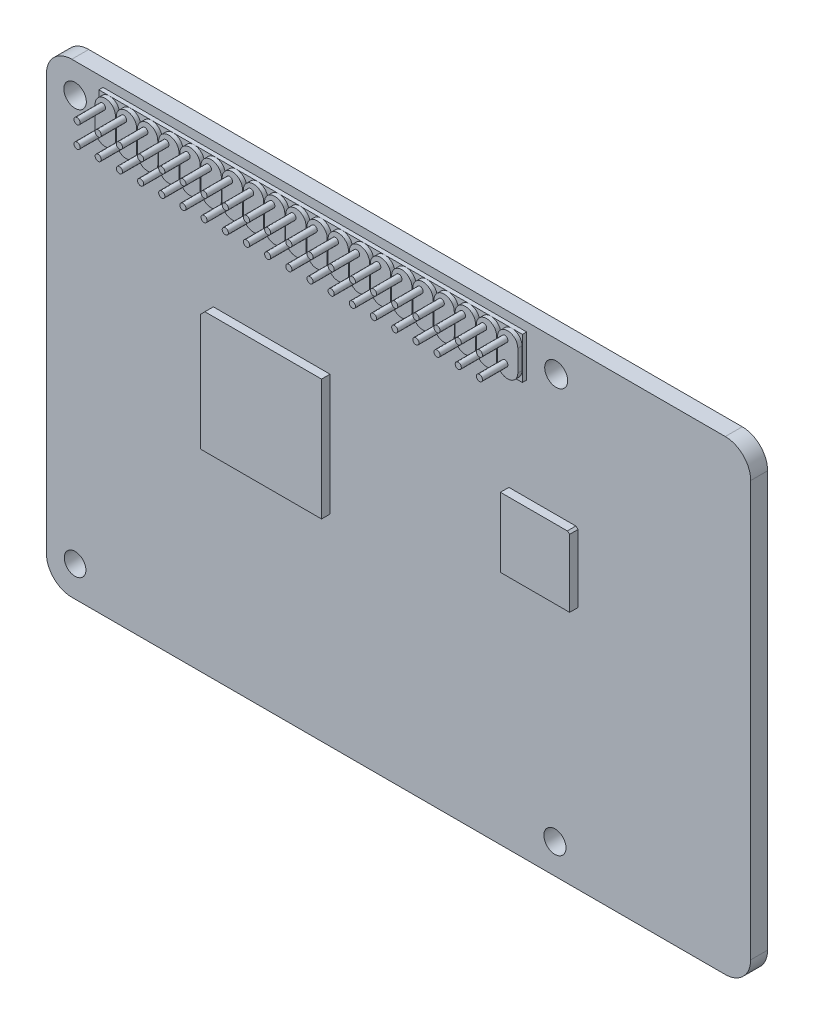
from build123d import *

# Parameters (mm, degrees)
BOSS_EXTRU_6_DEPTH      = 2
BOSS_EXTRU_8_DEPTH      = 1
ESQUISSE19_W            = 50.000582169
ESQUISSE19_H            = 4.923492373
BOSS_EXTRU_9_DEPTH      = 0.5
ESQUISSE20_R            = 0.361395421
BOSS_EXTRU_10_DEPTH     = 3
BOSS_EXTRU_11_DEPTH     = 1
BOSS_EXTRU_12_DEPTH     = 1
ESQUISSE23_R            = 1.328244068
ESQUISSE23_R_2          = 1.273931832
ESQUISSE23_R_3          = 1.307593734
ESQUISSE23_R_4          = 1.354217853
ENL_V_MAT_EXTRU_1_DEPTH = 21
ESQUISSE24_W            = 11.521914809
ESQUISSE24_H            = 11.164250047
BOSS_EXTRU_13_DEPTH     = 0.6
ESQUISSE25_W            = 0.5
ESQUISSE25_H            = 11
ENL_V_MAT_EXTRU_2_DEPTH = 11


with BuildPart() as part:
    # Esquisse13 → Boss.-Extru.6 (new body)
    with BuildSketch(Plane.XY):
        with BuildLine():
            Line((32.305129896, 231.75292532), (109.445129896, 231.75292532))
            ThreePointArc((109.445129896, 231.75292532), (111.56645024, 230.874245664), (112.445129896, 228.75292532))
            Line((112.445129896, 228.75292532), (112.445129896, 179.75292532))
            ThreePointArc((112.445129896, 179.75292532), (111.56645024, 177.631604977), (109.445129896, 176.75292532))
            Line((109.445129896, 176.75292532), (32.305129896, 176.75292532))
            ThreePointArc((32.305129896, 176.75292532), (30.183809552, 177.631604977), (29.305129896, 179.75292532))
            Line((29.305129896, 179.75292532), (29.305129896, 228.75292532))
            ThreePointArc((29.305129896, 228.75292532), (30.183809552, 230.874245664), (32.305129896, 231.75292532))
        make_face()
    extrude(amount=BOSS_EXTRU_6_DEPTH)

    # Esquisse18 → Boss.-Extru.8 (add)
    with BuildSketch(Plane.XY.offset(2)):
        with BuildLine():
            Line((38.45390288, 229.525786003), (38.45390288, 226.996845752))
            ThreePointArc((38.45390288, 226.996845752), (37.256626819, 225.799569691), (36.059350758, 226.996845752))
            Line((36.059350758, 226.996845752), (36.059350758, 229.525786003))
            ThreePointArc((36.059350758, 229.525786003), (37.256626819, 230.723062064), (38.45390288, 229.525786003))
        make_face()
        with BuildLine():
            Line((40.95390288, 229.525786003), (40.95390288, 226.996845752))
            ThreePointArc((40.95390288, 226.996845752), (39.756626819, 225.799569691), (38.559350758, 226.996845752))
            Line((38.559350758, 226.996845752), (38.559350758, 229.525786003))
            ThreePointArc((38.559350758, 229.525786003), (39.756626819, 230.723062064), (40.95390288, 229.525786003))
        make_face()
        with BuildLine():
            Line((43.45390288, 229.525786003), (43.45390288, 226.996845752))
            ThreePointArc((43.45390288, 226.996845752), (42.256626819, 225.799569691), (41.059350758, 226.996845752))
            Line((41.059350758, 226.996845752), (41.059350758, 229.525786003))
            ThreePointArc((41.059350758, 229.525786003), (42.256626819, 230.723062064), (43.45390288, 229.525786003))
        make_face()
        with BuildLine():
            Line((45.95390288, 229.525786003), (45.95390288, 226.996845752))
            ThreePointArc((45.95390288, 226.996845752), (44.756626819, 225.799569691), (43.559350758, 226.996845752))
            Line((43.559350758, 226.996845752), (43.559350758, 229.525786003))
            ThreePointArc((43.559350758, 229.525786003), (44.756626819, 230.723062064), (45.95390288, 229.525786003))
        make_face()
        with BuildLine():
            Line((48.45390288, 229.525786003), (48.45390288, 226.996845752))
            ThreePointArc((48.45390288, 226.996845752), (47.256626819, 225.799569691), (46.059350758, 226.996845752))
            Line((46.059350758, 226.996845752), (46.059350758, 229.525786003))
            ThreePointArc((46.059350758, 229.525786003), (47.256626819, 230.723062064), (48.45390288, 229.525786003))
        make_face()
        with BuildLine():
            Line((50.95390288, 229.525786003), (50.95390288, 226.996845752))
            ThreePointArc((50.95390288, 226.996845752), (49.756626819, 225.799569691), (48.559350758, 226.996845752))
            Line((48.559350758, 226.996845752), (48.559350758, 229.525786003))
            ThreePointArc((48.559350758, 229.525786003), (49.756626819, 230.723062064), (50.95390288, 229.525786003))
        make_face()
        with BuildLine():
            Line((53.45390288, 229.525786003), (53.45390288, 226.996845752))
            ThreePointArc((53.45390288, 226.996845752), (52.256626819, 225.799569691), (51.059350758, 226.996845752))
            Line((51.059350758, 226.996845752), (51.059350758, 229.525786003))
            ThreePointArc((51.059350758, 229.525786003), (52.256626819, 230.723062064), (53.45390288, 229.525786003))
        make_face()
        with BuildLine():
            Line((55.95390288, 229.525786003), (55.95390288, 226.996845752))
            ThreePointArc((55.95390288, 226.996845752), (54.756626819, 225.799569691), (53.559350758, 226.996845752))
            Line((53.559350758, 226.996845752), (53.559350758, 229.525786003))
            ThreePointArc((53.559350758, 229.525786003), (54.756626819, 230.723062064), (55.95390288, 229.525786003))
        make_face()
        with BuildLine():
            Line((58.45390288, 229.525786003), (58.45390288, 226.996845752))
            ThreePointArc((58.45390288, 226.996845752), (57.256626819, 225.799569691), (56.059350758, 226.996845752))
            Line((56.059350758, 226.996845752), (56.059350758, 229.525786003))
            ThreePointArc((56.059350758, 229.525786003), (57.256626819, 230.723062064), (58.45390288, 229.525786003))
        make_face()
        with BuildLine():
            Line((60.95390288, 229.525786003), (60.95390288, 226.996845752))
            ThreePointArc((60.95390288, 226.996845752), (59.756626819, 225.799569691), (58.559350758, 226.996845752))
            Line((58.559350758, 226.996845752), (58.559350758, 229.525786003))
            ThreePointArc((58.559350758, 229.525786003), (59.756626819, 230.723062064), (60.95390288, 229.525786003))
        make_face()
        with BuildLine():
            Line((63.45390288, 229.525786003), (63.45390288, 226.996845752))
            ThreePointArc((63.45390288, 226.996845752), (62.256626819, 225.799569691), (61.059350758, 226.996845752))
            Line((61.059350758, 226.996845752), (61.059350758, 229.525786003))
            ThreePointArc((61.059350758, 229.525786003), (62.256626819, 230.723062064), (63.45390288, 229.525786003))
        make_face()
        with BuildLine():
            Line((65.95390288, 229.525786003), (65.95390288, 226.996845752))
            ThreePointArc((65.95390288, 226.996845752), (64.756626819, 225.799569691), (63.559350758, 226.996845752))
            Line((63.559350758, 226.996845752), (63.559350758, 229.525786003))
            ThreePointArc((63.559350758, 229.525786003), (64.756626819, 230.723062064), (65.95390288, 229.525786003))
        make_face()
        with BuildLine():
            Line((68.45390288, 229.525786003), (68.45390288, 226.996845752))
            ThreePointArc((68.45390288, 226.996845752), (67.256626819, 225.799569691), (66.059350758, 226.996845752))
            Line((66.059350758, 226.996845752), (66.059350758, 229.525786003))
            ThreePointArc((66.059350758, 229.525786003), (67.256626819, 230.723062064), (68.45390288, 229.525786003))
        make_face()
        with BuildLine():
            Line((70.95390288, 229.525786003), (70.95390288, 226.996845752))
            ThreePointArc((70.95390288, 226.996845752), (69.756626819, 225.799569691), (68.559350758, 226.996845752))
            Line((68.559350758, 226.996845752), (68.559350758, 229.525786003))
            ThreePointArc((68.559350758, 229.525786003), (69.756626819, 230.723062064), (70.95390288, 229.525786003))
        make_face()
        with BuildLine():
            Line((73.45390288, 229.525786003), (73.45390288, 226.996845752))
            ThreePointArc((73.45390288, 226.996845752), (72.256626819, 225.799569691), (71.059350758, 226.996845752))
            Line((71.059350758, 226.996845752), (71.059350758, 229.525786003))
            ThreePointArc((71.059350758, 229.525786003), (72.256626819, 230.723062064), (73.45390288, 229.525786003))
        make_face()
        with BuildLine():
            Line((75.95390288, 229.525786003), (75.95390288, 226.996845752))
            ThreePointArc((75.95390288, 226.996845752), (74.756626819, 225.799569691), (73.559350758, 226.996845752))
            Line((73.559350758, 226.996845752), (73.559350758, 229.525786003))
            ThreePointArc((73.559350758, 229.525786003), (74.756626819, 230.723062064), (75.95390288, 229.525786003))
        make_face()
        with BuildLine():
            Line((78.45390288, 229.525786003), (78.45390288, 226.996845752))
            ThreePointArc((78.45390288, 226.996845752), (77.256626819, 225.799569691), (76.059350758, 226.996845752))
            Line((76.059350758, 226.996845752), (76.059350758, 229.525786003))
            ThreePointArc((76.059350758, 229.525786003), (77.256626819, 230.723062064), (78.45390288, 229.525786003))
        make_face()
        with BuildLine():
            Line((80.95390288, 229.525786003), (80.95390288, 226.996845752))
            ThreePointArc((80.95390288, 226.996845752), (79.756626819, 225.799569691), (78.559350758, 226.996845752))
            Line((78.559350758, 226.996845752), (78.559350758, 229.525786003))
            ThreePointArc((78.559350758, 229.525786003), (79.756626819, 230.723062064), (80.95390288, 229.525786003))
        make_face()
        with BuildLine():
            Line((83.45390288, 229.525786003), (83.45390288, 226.996845752))
            ThreePointArc((83.45390288, 226.996845752), (82.256626819, 225.799569691), (81.059350758, 226.996845752))
            Line((81.059350758, 226.996845752), (81.059350758, 229.525786003))
            ThreePointArc((81.059350758, 229.525786003), (82.256626819, 230.723062064), (83.45390288, 229.525786003))
        make_face()
        with BuildLine():
            Line((85.95390288, 229.525786003), (85.95390288, 226.996845752))
            ThreePointArc((85.95390288, 226.996845752), (84.756626819, 225.799569691), (83.559350758, 226.996845752))
            Line((83.559350758, 226.996845752), (83.559350758, 229.525786003))
            ThreePointArc((83.559350758, 229.525786003), (84.756626819, 230.723062064), (85.95390288, 229.525786003))
        make_face()
    extrude(amount=BOSS_EXTRU_8_DEPTH)

    # Esquisse19 → Boss.-Extru.9 (add)
    with BuildSketch(Plane.XY.offset(2)):
        with Locations((60.994551794, 228.261315878)):
            Rectangle(ESQUISSE19_W, ESQUISSE19_H)
    extrude(amount=BOSS_EXTRU_9_DEPTH)

    # Esquisse20 → Boss.-Extru.10 (add)
    with BuildSketch(Plane.XY.offset(3)):
        with Locations((36.923630674, 229.735044797)):
            Circle(ESQUISSE20_R)
        with Locations((36.923630674, 227.230180834)):
            Circle(ESQUISSE20_R)
        with Locations((39.423630674, 229.735044797)):
            Circle(ESQUISSE20_R)
        with Locations((39.423630674, 227.230180834)):
            Circle(ESQUISSE20_R)
        with Locations((41.923630674, 229.735044797)):
            Circle(ESQUISSE20_R)
        with Locations((41.923630674, 227.230180834)):
            Circle(ESQUISSE20_R)
        with Locations((44.423630674, 229.735044797)):
            Circle(ESQUISSE20_R)
        with Locations((44.423630674, 227.230180834)):
            Circle(ESQUISSE20_R)
        with Locations((46.923630674, 229.735044797)):
            Circle(ESQUISSE20_R)
        with Locations((46.923630674, 227.230180834)):
            Circle(ESQUISSE20_R)
        with Locations((49.423630674, 229.735044797)):
            Circle(ESQUISSE20_R)
        with Locations((49.423630674, 227.230180834)):
            Circle(ESQUISSE20_R)
        with Locations((51.923630674, 229.735044797)):
            Circle(ESQUISSE20_R)
        with Locations((51.923630674, 227.230180834)):
            Circle(ESQUISSE20_R)
        with Locations((54.423630674, 229.735044797)):
            Circle(ESQUISSE20_R)
        with Locations((54.423630674, 227.230180834)):
            Circle(ESQUISSE20_R)
        with Locations((56.923630674, 229.735044797)):
            Circle(ESQUISSE20_R)
        with Locations((56.923630674, 227.230180834)):
            Circle(ESQUISSE20_R)
        with Locations((59.423630674, 229.735044797)):
            Circle(ESQUISSE20_R)
        with Locations((59.423630674, 227.230180834)):
            Circle(ESQUISSE20_R)
        with Locations((61.923630674, 229.735044797)):
            Circle(ESQUISSE20_R)
        with Locations((61.923630674, 227.230180834)):
            Circle(ESQUISSE20_R)
        with Locations((64.423630674, 229.735044797)):
            Circle(ESQUISSE20_R)
        with Locations((64.423630674, 227.230180834)):
            Circle(ESQUISSE20_R)
        with Locations((66.923630674, 229.735044797)):
            Circle(ESQUISSE20_R)
        with Locations((66.923630674, 227.230180834)):
            Circle(ESQUISSE20_R)
        with Locations((69.423630674, 229.735044797)):
            Circle(ESQUISSE20_R)
        with Locations((69.423630674, 227.230180834)):
            Circle(ESQUISSE20_R)
        with Locations((71.923630674, 229.735044797)):
            Circle(ESQUISSE20_R)
        with Locations((71.923630674, 227.230180834)):
            Circle(ESQUISSE20_R)
        with Locations((74.423630674, 229.735044797)):
            Circle(ESQUISSE20_R)
        with Locations((74.423630674, 227.230180834)):
            Circle(ESQUISSE20_R)
        with Locations((76.923630674, 229.735044797)):
            Circle(ESQUISSE20_R)
        with Locations((76.923630674, 227.230180834)):
            Circle(ESQUISSE20_R)
        with Locations((79.423630674, 229.735044797)):
            Circle(ESQUISSE20_R)
        with Locations((79.423630674, 227.230180834)):
            Circle(ESQUISSE20_R)
        with Locations((81.923630674, 229.735044797)):
            Circle(ESQUISSE20_R)
        with Locations((81.923630674, 227.230180834)):
            Circle(ESQUISSE20_R)
        with Locations((84.423630674, 229.735044797)):
            Circle(ESQUISSE20_R)
        with Locations((84.423630674, 227.230180834)):
            Circle(ESQUISSE20_R)
    extrude(amount=BOSS_EXTRU_10_DEPTH)

    # Esquisse21 → Boss.-Extru.11 (add)
    with BuildSketch(Plane.XY.offset(2)):
        Polygon((48.488516054, 214.268809703), (49.016471277, 214.796764927), (62.788516054, 214.796764927), (62.788516054, 200.496764927), (48.488516054, 200.496764927), align=None)
        Polygon((91.803833516, 213.783801688), (92.074770526, 213.57243471), (92.074770526, 205.593801688), (83.904770526, 205.593801688), (83.904770526, 213.783801688), align=None)
    extrude(amount=BOSS_EXTRU_11_DEPTH)

    # Esquisse22 → Boss.-Extru.12 (add)
    with BuildSketch(Plane(origin=(0, 0, 0), x_dir=(-1, 0, 0), z_dir=(0, 0, -1))):
        Polygon((-77.907458558, 215.11992983), (-77.553508103, 215.473880284), (-65.83262736, 215.473880284), (-65.83262736, 203.327175091), (-77.907458558, 203.327175091), align=None)
    extrude(amount=BOSS_EXTRU_12_DEPTH)

    # Esquisse23 → Enlèv. mat.-Extru.1 (cut)
    with BuildSketch(Plane.XY.offset(2)):
        with Locations((32.694134004, 228.255987092)):
            Circle(ESQUISSE23_R)
        with Locations((32.694134004, 180.360866607)):
            Circle(ESQUISSE23_R_2)
        with Locations((89.338935231, 180.290306089)):
            Circle(ESQUISSE23_R_3)
        with Locations((89.485148951, 228.145857585)):
            Circle(ESQUISSE23_R_4)
    extrude(amount=-ENL_V_MAT_EXTRU_1_DEPTH, mode=Mode.SUBTRACT)

    # Esquisse24 → Boss.-Extru.13 (add)
    with BuildSketch(Plane(origin=(0, 0, 0), x_dir=(-1, 0, 0), z_dir=(0, 0, -1))):
        with Locations((-36.198901628, 204.128361795)):
            Rectangle(ESQUISSE24_W, ESQUISSE24_H)
    extrude(amount=BOSS_EXTRU_13_DEPTH)

    # Esquisse25 → Enlèv. mat.-Extru.2 (cut)
    with BuildSketch(Plane.ZY.offset(-30.437944223)):
        with Locations((-0.25, 204.121344589)):
            Rectangle(ESQUISSE25_W, ESQUISSE25_H)
    extrude(amount=-ENL_V_MAT_EXTRU_2_DEPTH, mode=Mode.SUBTRACT)


solid = part.part
